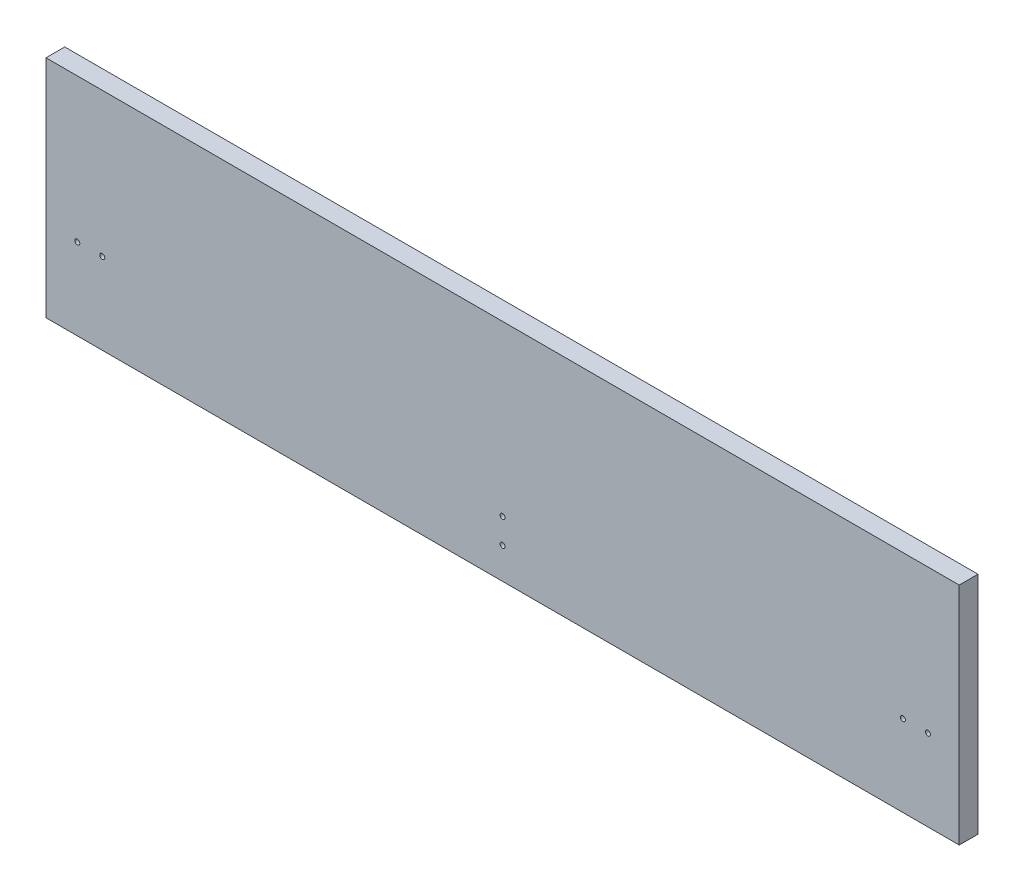
from build123d import *

# Parameters (mm, degrees)
CROQUIS1_W              = 730
CROQUIS1_H              = 180
SALIENTE_EXTRUIR1_DEPTH = 15
CROQUIS2_R              = 2
CORTAR_EXTRUIR1_DEPTH   = 10


with BuildPart() as part:
    # Croquis1 → Saliente-Extruir1 (new body)
    with BuildSketch(Plane.XY):
        Rectangle(CROQUIS1_W, CROQUIS1_H)
    extrude(amount=SALIENTE_EXTRUIR1_DEPTH)

    # Croquis2 → Cortar-Extruir1 (cut)
    with BuildSketch(Plane.XY.offset(15)):
        with Locations((-340, -25)):
            Circle(CROQUIS2_R)
        with Locations((0, -65)):
            Circle(CROQUIS2_R)
        with Locations((0, -45)):
            Circle(CROQUIS2_R)
        with Locations((-320, -25)):
            Circle(CROQUIS2_R)
        with Locations((340, -25)):
            Circle(CROQUIS2_R)
        with Locations((320, -25)):
            Circle(CROQUIS2_R)
    extrude(amount=-CORTAR_EXTRUIR1_DEPTH, mode=Mode.SUBTRACT)


solid = part.part
